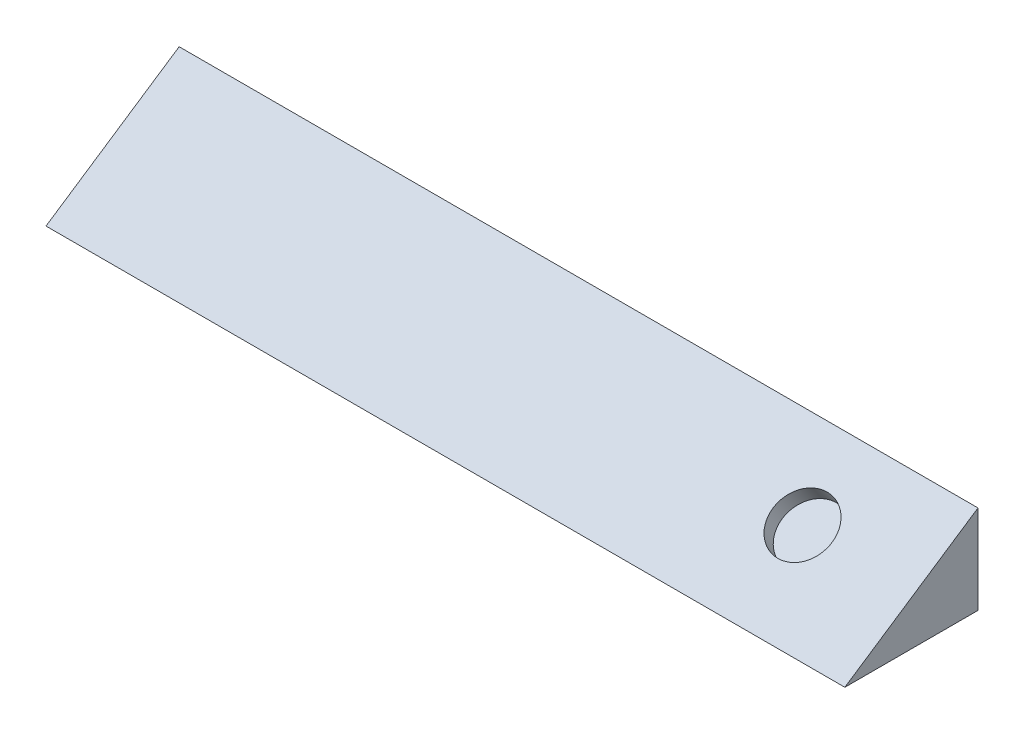
from build123d import *

# Parameters (mm, degrees)
BOSS_EXTRUDE1_DEPTH = 914.4
SKETCH6_R           = 33.902275387
CUT_EXTRUDE1_DEPTH  = 19.05


with BuildPart() as part:
    # Sketch1 → Boss-Extrude1 (new body)
    with BuildSketch(Plane(origin=(0, 0, 0), x_dir=(0, 0, -1), z_dir=(1, 0, 0))):
        Polygon((-20.432712568, 83.174071702), (-172.832712568, -18.425928298), (-20.432712568, -18.425928298), align=None)
    extrude(amount=BOSS_EXTRUDE1_DEPTH)

    # Sketch6 → Cut-Extrude1 (cut)
    with BuildSketch(Plane(origin=(0, 67.012532364, 44.675021576), x_dir=(1, 0, 0), z_dir=(0, 0.8320502943378435, 0.5547001962252294))):
        with Locations(Location((784.078611342, -55.644211071, 0), (0, 0, 270))):
            Circle(SKETCH6_R)
    extrude(amount=-CUT_EXTRUDE1_DEPTH, mode=Mode.SUBTRACT)


solid = part.part
